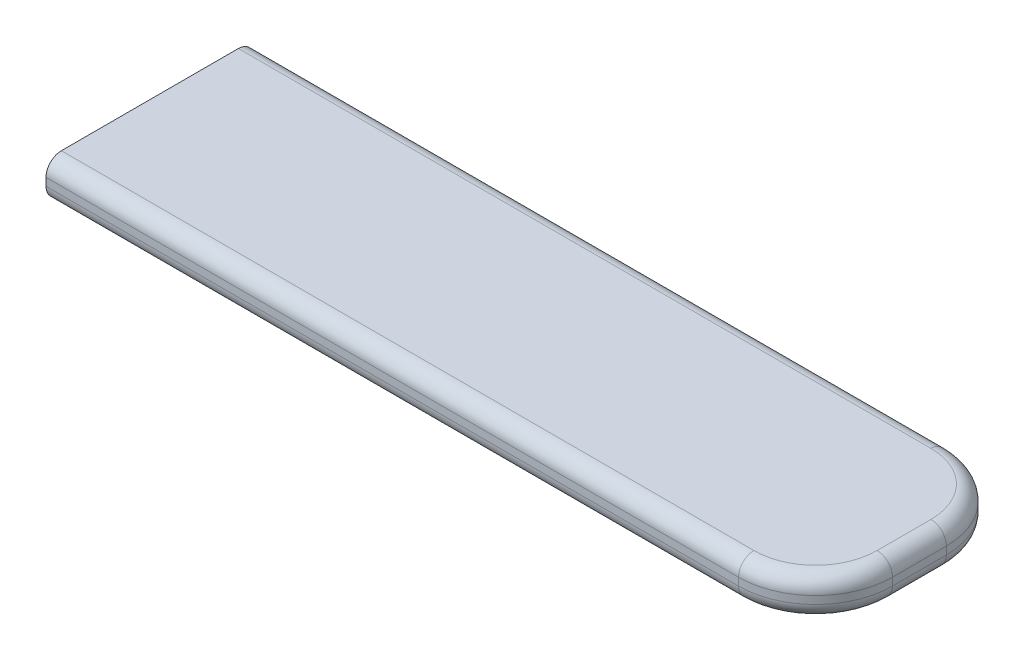
from build123d import *

# Parameters (mm, degrees)
SKETCH1_W           = 1000
SKETCH1_H           = 270
BOSS_EXTRUDE1_DEPTH = 50
FILLET1_R           = 100
FILLET2_R           = 20


with BuildPart() as part:
    # Sketch1 → Boss-Extrude1 (new body)
    with BuildSketch(Plane(origin=(0, 0, 0), x_dir=(1, 0, 0), z_dir=(0, 1, 0))):
        with Locations((-500, 135)):
            Rectangle(SKETCH1_W, SKETCH1_H)
    extrude(amount=BOSS_EXTRUDE1_DEPTH)

    # Fillet1
    fillet1_edges = [part.edges().sort_by_distance(p)[0] for p in [
        (0, 25, 0),
        (0, 25, -270),
    ]]
    fillet(fillet1_edges, radius=FILLET1_R)

    # Fillet2
    fillet2_edges = [part.edges().sort_by_distance(p)[0] for p in [
        (-550, 0, -270),
        (-550, 50, -270),
        (0, 0, -135),
        (-550, 0, 0),
        (-29.289321881, 0, -29.289321881),
        (-29.289321881, 0, -240.710678119),
        (0, 50, -135),
        (-550, 50, 0),
        (-29.289321881, 50, -29.289321881),
        (-29.289321881, 50, -240.710678119),
    ]]
    fillet(fillet2_edges, radius=FILLET2_R)


solid = part.part
